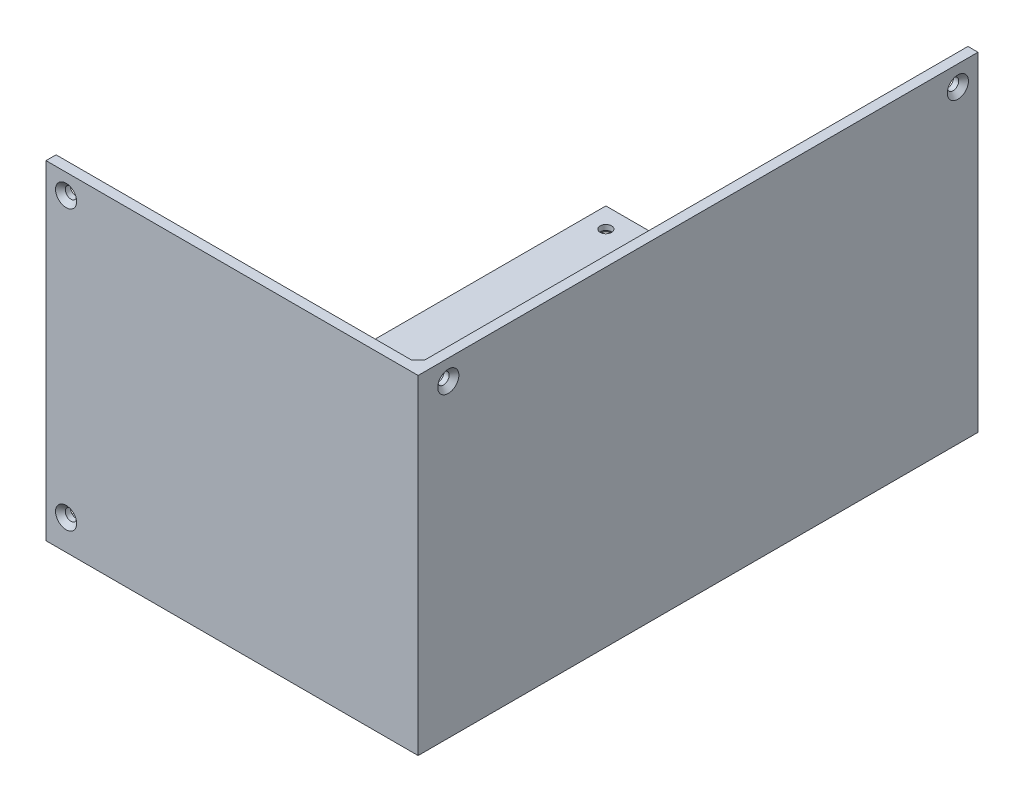
from build123d import *

# Parameters (mm, degrees)
SKETCH2_W                                      = 108
SKETCH2_H                                      = 95.2
BOSS_EXTRUDE1_DEPTH                            = 3
SKETCH3_W                                      = 167
SKETCH3_H                                      = 95.2
BOSS_EXTRUDE2_DEPTH                            = 3
SKETCH4_W                                      = 111
SKETCH4_H                                      = 167
BOSS_EXTRUDE3_DEPTH                            = 3
CSK_FOR_M3_FLAT_HEAD_MACHINE_SCREW1_AT_2_COUNT = 2
CSK_FOR_M3_FLAT_HEAD_MACHINE_SCREW1_AT_2_PITCH = 83.2
CSK_FOR_M3_FLAT_HEAD_MACHINE_SCREW2_AT_2_COUNT = 2
CSK_FOR_M3_FLAT_HEAD_MACHINE_SCREW2_AT_2_PITCH = 96
CSK_FOR_M3_FLAT_HEAD_MACHINE_SCREW3_AT_2_COUNT = 2
CSK_FOR_M3_FLAT_HEAD_MACHINE_SCREW3_AT_2_PITCH = 152
CUT_EXTRUDE1_REACH                             = 221.552
SKETCH12_W                                     = 6.5
SKETCH12_H                                     = 12
SKETCH12_W_2                                   = 6.2
SKETCH12_H_2                                   = 16
FILLET1_R                                      = 2
CHAMFER1_SIZE                                  = 2


with BuildPart() as part:
    # Sketch2 → Boss-Extrude1 (new body)
    with BuildSketch(Plane.XY):
        with Locations((51, 10.6)):
            Rectangle(SKETCH2_W, SKETCH2_H)
    extrude(amount=BOSS_EXTRUDE1_DEPTH)

    # Sketch3 → Boss-Extrude2 (add)
    with BuildSketch(Plane(origin=(105, 0, 0), x_dir=(0, 0, -1), z_dir=(1, 0, 0))):
        with Locations((80.5, 10.6)):
            Rectangle(SKETCH3_W, SKETCH3_H)
    extrude(amount=BOSS_EXTRUDE2_DEPTH)

    # Sketch4 → Boss-Extrude3 (add)
    with BuildSketch(Plane.XZ.offset(37)):
        with Locations((52.5, -80.5)):
            Rectangle(SKETCH4_W, SKETCH4_H)
    extrude(amount=BOSS_EXTRUDE3_DEPTH)

    # Sketch6 → CSK for M3 Flat Head Machine Screw1 (revolve, cut)
    with BuildSketch(Plane(origin=(3, -31, 3), x_dir=(0, -1, 0), z_dir=(1, 0, 0))):
        Polygon((0, 0), (0, 3), (1.7, 3), (1.7, 1.45), (3.15, 0), align=None)
    csk_for_m3_flat_head_machine_screw1 = revolve(axis=Axis((3, -31, 9.35), (0, 0, -1)), mode=Mode.SUBTRACT)

    # CSK for M3 Flat Head Machine Screw1 at 2: CSK for M3 Flat Head Machine Screw1 ×2
    with Locations(*[(0, i * CSK_FOR_M3_FLAT_HEAD_MACHINE_SCREW1_AT_2_PITCH, 0) for i in range(1, CSK_FOR_M3_FLAT_HEAD_MACHINE_SCREW1_AT_2_COUNT)]):
        add(csk_for_m3_flat_head_machine_screw1, mode=Mode.SUBTRACT)

    # Sketch8 → CSK for M3 Flat Head Machine Screw2 (revolve, cut)
    with BuildSketch(Plane(origin=(3, -40, -158), x_dir=(0, 0, -1), z_dir=(1, 0, 0))):
        Polygon((0, 0), (0, 3), (1.7, 3), (1.7, 1.45), (3.15, 0), align=None)
    csk_for_m3_flat_head_machine_screw2 = revolve(axis=Axis((3, -46.35, -158), (0, 1, 0)), mode=Mode.SUBTRACT)

    # CSK for M3 Flat Head Machine Screw2 at 2: CSK for M3 Flat Head Machine Screw2 ×2
    with Locations(*[(i * CSK_FOR_M3_FLAT_HEAD_MACHINE_SCREW2_AT_2_PITCH, 0, 0) for i in range(1, CSK_FOR_M3_FLAT_HEAD_MACHINE_SCREW2_AT_2_COUNT)]):
        add(csk_for_m3_flat_head_machine_screw2, mode=Mode.SUBTRACT)

    # Sketch10 → CSK for M3 Flat Head Machine Screw3 (revolve, cut)
    with BuildSketch(Plane(origin=(108, 52.2, -6), x_dir=(0, 0, -1), z_dir=(0, 1, 0))):
        Polygon((0, 0), (0, 3), (1.7, 3), (1.7, 1.45), (3.15, 0), align=None)
    csk_for_m3_flat_head_machine_screw3 = revolve(axis=Axis((114.35, 52.2, -6), (-1, 0, 0)), mode=Mode.SUBTRACT)

    # CSK for M3 Flat Head Machine Screw3 at 2: CSK for M3 Flat Head Machine Screw3 ×2
    with Locations(*[(0, 0, -i * CSK_FOR_M3_FLAT_HEAD_MACHINE_SCREW3_AT_2_PITCH) for i in range(1, CSK_FOR_M3_FLAT_HEAD_MACHINE_SCREW3_AT_2_COUNT)]):
        add(csk_for_m3_flat_head_machine_screw3, mode=Mode.SUBTRACT)

    # Sketch12 → Cut-Extrude1 (cut, up to next)
    with BuildSketch(Plane.XZ.offset(40), mode=Mode.PRIVATE) as cut_extrude1_sk1:
        with Locations((41.25, -15.5)):
            Rectangle(SKETCH12_W, SKETCH12_H)
    cut_extrude1_tool1 = extrude(cut_extrude1_sk1.sketch, amount=-CUT_EXTRUDE1_REACH, mode=Mode.PRIVATE) & part.part
    # Sketch12 → Cut-Extrude1 (cut, up to next)
    with BuildSketch(Plane.XZ.offset(40), mode=Mode.PRIVATE) as cut_extrude1_sk2:
        with Locations((86.5, -17.5)):
            Rectangle(SKETCH12_W_2, SKETCH12_H_2)
    cut_extrude1_tool2 = extrude(cut_extrude1_sk2.sketch, amount=-CUT_EXTRUDE1_REACH, mode=Mode.PRIVATE) & part.part
    # Sketch12 → Cut-Extrude1 (cut, up to next)
    with BuildSketch(Plane.XZ.offset(40), mode=Mode.PRIVATE) as cut_extrude1_sk3:
        with Locations((86.5, -143.5)):
            Rectangle(SKETCH12_W_2, SKETCH12_H_2)
    cut_extrude1_tool3 = extrude(cut_extrude1_sk3.sketch, amount=-CUT_EXTRUDE1_REACH, mode=Mode.PRIVATE) & part.part
    # Sketch12 → Cut-Extrude1 (cut, up to next)
    with BuildSketch(Plane.XZ.offset(40), mode=Mode.PRIVATE) as cut_extrude1_sk4:
        with Locations((41.25, -145.5)):
            Rectangle(SKETCH12_W, SKETCH12_H)
    cut_extrude1_tool4 = extrude(cut_extrude1_sk4.sketch, amount=-CUT_EXTRUDE1_REACH, mode=Mode.PRIVATE) & part.part
    add(cut_extrude1_tool1.solids().sort_by_distance((41.25, -40, -15.5))[0], mode=Mode.SUBTRACT)
    add(cut_extrude1_tool2.solids().sort_by_distance((86.5, -40, -17.5))[0], mode=Mode.SUBTRACT)
    add(cut_extrude1_tool3.solids().sort_by_distance((86.5, -40, -143.5))[0], mode=Mode.SUBTRACT)
    add(cut_extrude1_tool4.solids().sort_by_distance((41.25, -40, -145.5))[0], mode=Mode.SUBTRACT)

    # Fillet1
    fillet1_edges = [part.edges().sort_by_distance(p)[0] for p in [
        (44.5, -38.5, -139.5),
        (44.5, -38.5, -151.5),
        (38, -38.5, -151.5),
        (38, -38.5, -139.5),
        (89.6, -38.5, -135.5),
        (89.6, -38.5, -151.5),
        (83.4, -38.5, -151.5),
        (83.4, -38.5, -135.5),
        (83.4, -38.5, -9.5),
        (89.6, -38.5, -9.5),
        (89.6, -38.5, -25.5),
        (83.4, -38.5, -25.5),
        (38, -38.5, -9.5),
        (44.5, -38.5, -9.5),
        (44.5, -38.5, -21.5),
        (38, -38.5, -21.5),
    ]]
    fillet(fillet1_edges, radius=FILLET1_R)

    # Chamfer1
    chamfer1_edges = [part.edges().sort_by_distance(p)[0] for p in [
        (105, -37, -82),
        (105, 10.6, 0),
        (51, -37, 0),
    ]]
    chamfer(chamfer1_edges, length=CHAMFER1_SIZE)


solid = part.part
